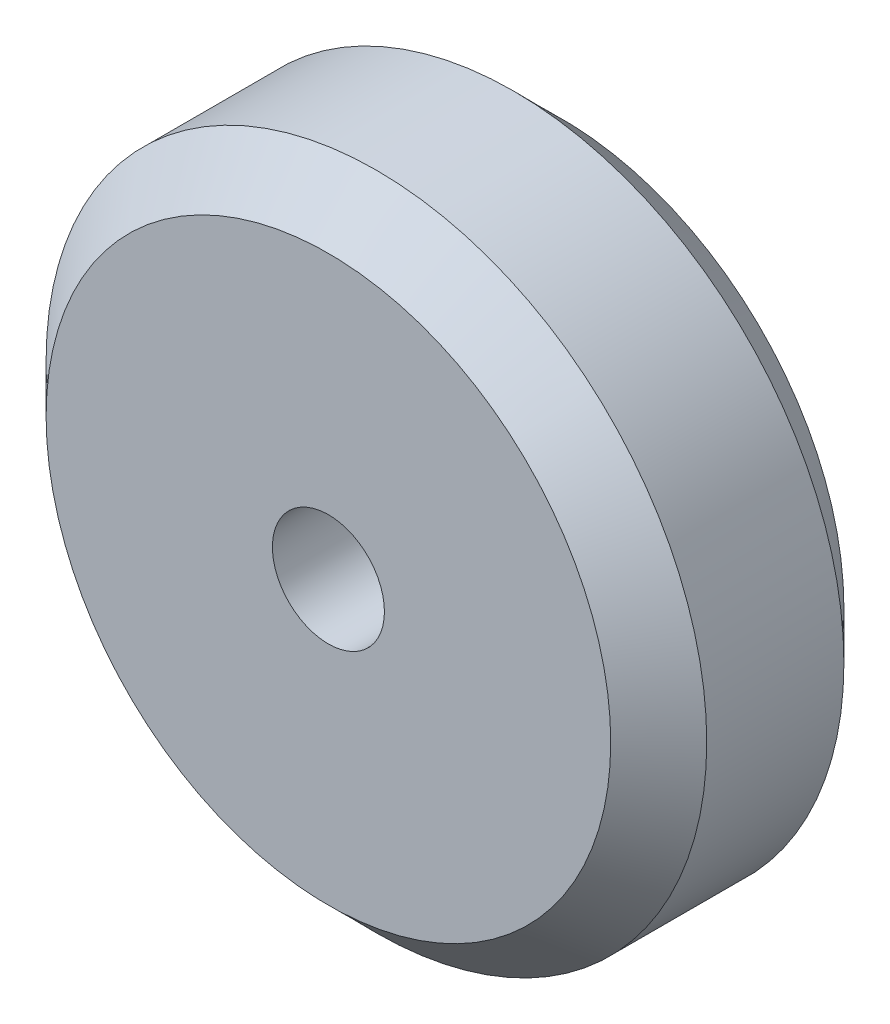
from build123d import *


with BuildPart() as part:
    # Sketch1 → Revolve1 (revolve)
    with BuildSketch(Plane(origin=(0, 0, 0), x_dir=(0, 0, -1), z_dir=(1, 0, 0)), mode=Mode.PRIVATE) as revolve1_sk:
        Polygon((-5.1, 2.45), (-5.1, 12.35), (-3, 14.45), (3, 14.45), (5.1, 12.35), (5.1, 2.45), align=None)
    revolve(revolve1_sk.sketch.rotate(Axis((0, 0, 5.1), (0, 0, -1)), 90), axis=Axis((0, 0, 5.1), (0, 0, -1)))


solid = part.part
